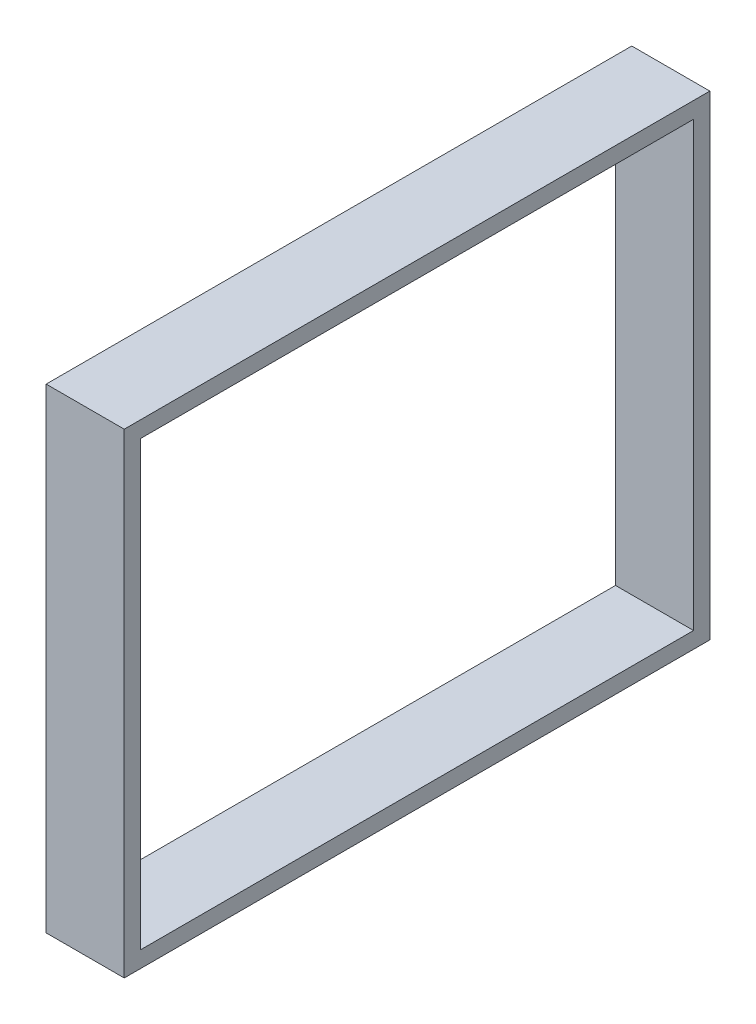
from build123d import *

# Parameters (mm, degrees)
TIE_SKETCH_W   = 36
TIE_SKETCH_H   = 29.22
TIE_SKETCH_W_2 = 34
TIE_SKETCH_H_2 = 27.22
TIE_DEPTH      = 2.4


with BuildPart() as part:
    # Tie Sketch → Tie (new, symmetric)
    with BuildSketch(Plane(origin=(0, 0, 0), x_dir=(0, 0, -1), z_dir=(1, 0, 0))):
        with Locations((0, 82.16)):
            Rectangle(TIE_SKETCH_W, TIE_SKETCH_H)
        with Locations((0, 82.16)):
            Rectangle(TIE_SKETCH_W_2, TIE_SKETCH_H_2, mode=Mode.SUBTRACT)
    extrude(amount=TIE_DEPTH, both=True)


solid = part.part
